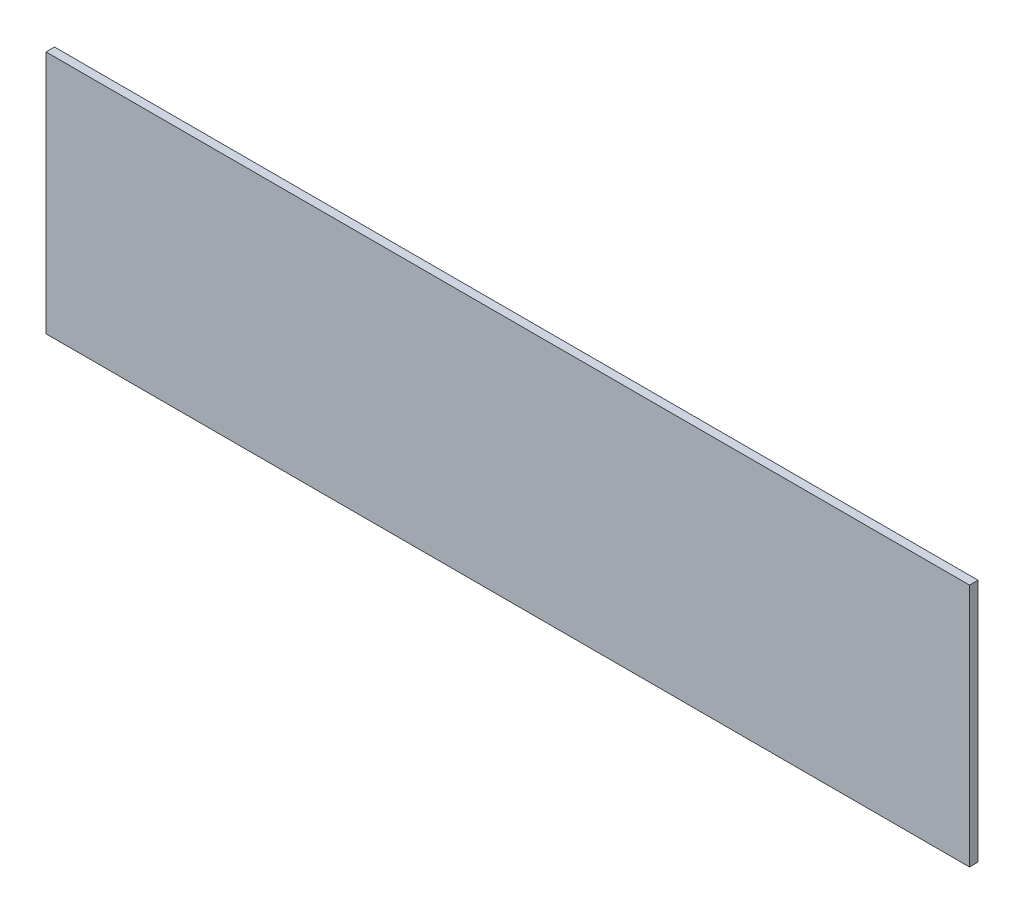
from build123d import *

# Parameters (mm, degrees)
SKETCH1_W           = 435
SKETCH1_H           = 115
BOSS_EXTRUDE1_DEPTH = 4


with BuildPart() as part:
    # Sketch1 → Boss-Extrude1 (new body)
    with BuildSketch(Plane.XY):
        Rectangle(SKETCH1_W, SKETCH1_H)
    extrude(amount=BOSS_EXTRUDE1_DEPTH)


solid = part.part
